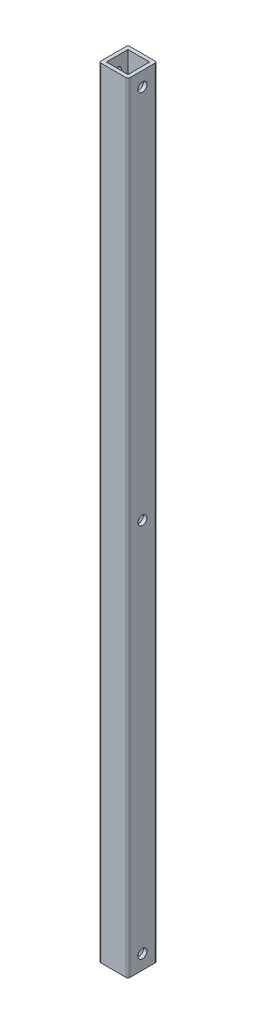
from build123d import *

# Parameters (mm, degrees)
SKETCH1_W           = 16
SKETCH1_H           = 16
SKETCH1_W_2         = 12
SKETCH1_H_2         = 12
BOSS_EXTRUDE1_DEPTH = 432
FILLET1_R           = 1
SKETCH2_R           = 2.5
CUT_EXTRUDE1_DEPTH  = 16
SKETCH3_R           = 2.5
CUT_EXTRUDE2_DEPTH  = 16


with BuildPart() as part:
    # Sketch1 → Boss-Extrude1 (new body)
    with BuildSketch(Plane(origin=(0, 0, 0), x_dir=(1, 0, 0), z_dir=(0, 1, 0))):
        with Locations((2.483870968, -2.225806452)):
            Rectangle(SKETCH1_W, SKETCH1_H)
        with Locations((2.483870968, -2.225806452)):
            Rectangle(SKETCH1_W_2, SKETCH1_H_2, mode=Mode.SUBTRACT)
    extrude(amount=BOSS_EXTRUDE1_DEPTH)

    # Fillet1
    fillet1_edges = [part.edges().sort_by_distance(p)[0] for p in [
        (-5.516129032, 216, -5.774193548),
        (10.483870968, 216, -5.774193548),
        (10.483870968, 216, 10.225806452),
        (-5.516129032, 216, 10.225806452),
    ]]
    fillet(fillet1_edges, radius=FILLET1_R)

    # Sketch2 → Cut-Extrude1 (cut)
    with BuildSketch(Plane.ZY.offset(5.516129032)):
        with Locations((2.225806452, 424)):
            Circle(SKETCH2_R)
        with Locations((2.225806452, 8)):
            Circle(SKETCH2_R)
    extrude(amount=-CUT_EXTRUDE1_DEPTH, mode=Mode.SUBTRACT)

    # Sketch3 → Cut-Extrude2 (cut)
    with BuildSketch(Plane.ZY.offset(5.516129032)):
        with Locations((2.225806452, 216)):
            Circle(SKETCH3_R)
    extrude(amount=-CUT_EXTRUDE2_DEPTH, mode=Mode.SUBTRACT)


solid = part.part
